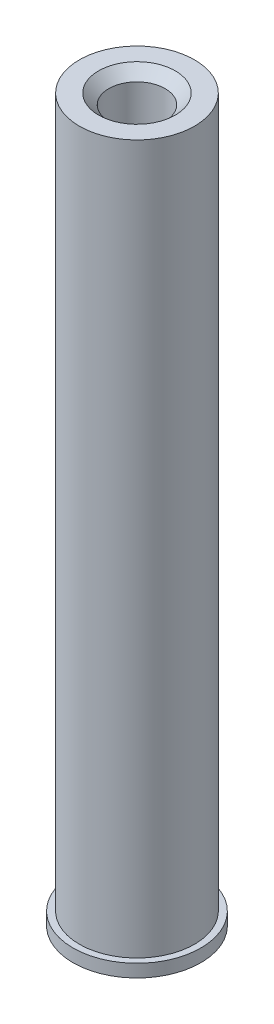
from build123d import *

# Parameters (mm, degrees)
SKETCH1_R                                           = 2.5
BOSS_EXTRUDE1_DEPTH                                 = 0.5
SKETCH2_R                                           = 2.25
BOSS_EXTRUDE2_DEPTH                                 = 27.7
CSK_FOR_M2_COUNTERSUNK_FLAT_HEAD_SCREW1_D           = 2.2
CSK_FOR_M2_COUNTERSUNK_FLAT_HEAD_SCREW1_DEPTH       = 9.339053319
CSK_FOR_M2_COUNTERSUNK_FLAT_HEAD_SCREW1_CSINK_D     = 3
CSK_FOR_M2_COUNTERSUNK_FLAT_HEAD_SCREW1_CSINK_ANGLE = 90
CSK_FOR_M2_COUNTERSUNK_FLAT_HEAD_SCREW1_TIP         = 0.660946681


with BuildPart() as part:
    # Sketch1 → Boss-Extrude1 (new body)
    with BuildSketch(Plane(origin=(0, 0, 0), x_dir=(1, 0, 0), z_dir=(0, 1, 0))):
        with Locations(Location((0, 0, 0), (0, 0, 270))):
            Circle(SKETCH1_R)
    extrude(amount=BOSS_EXTRUDE1_DEPTH)

    # Sketch2 → Boss-Extrude2 (add)
    with BuildSketch(Plane(origin=(0, 0.5, 0), x_dir=(1, 0, 0), z_dir=(0, 1, 0))):
        with Locations(Location((0, 0, 0), (0, 0, 270))):
            Circle(SKETCH2_R)
    extrude(amount=BOSS_EXTRUDE2_DEPTH)

    # CSK for M2 Countersunk Flat Head Screw1
    with Locations(Plane(origin=(0, 28.2, 0), x_dir=(1, 0, 0), z_dir=(0, 1, 0))):
        with Locations((0, 0)):
            CounterSinkHole(CSK_FOR_M2_COUNTERSUNK_FLAT_HEAD_SCREW1_D / 2, CSK_FOR_M2_COUNTERSUNK_FLAT_HEAD_SCREW1_CSINK_D / 2, depth=CSK_FOR_M2_COUNTERSUNK_FLAT_HEAD_SCREW1_DEPTH, counter_sink_angle=CSK_FOR_M2_COUNTERSUNK_FLAT_HEAD_SCREW1_CSINK_ANGLE)
            with Locations((0, 0, -(CSK_FOR_M2_COUNTERSUNK_FLAT_HEAD_SCREW1_DEPTH + CSK_FOR_M2_COUNTERSUNK_FLAT_HEAD_SCREW1_TIP / 2))):  # 118° drill point
                Cone(0, CSK_FOR_M2_COUNTERSUNK_FLAT_HEAD_SCREW1_D / 2, CSK_FOR_M2_COUNTERSUNK_FLAT_HEAD_SCREW1_TIP, mode=Mode.SUBTRACT)


solid = part.part
